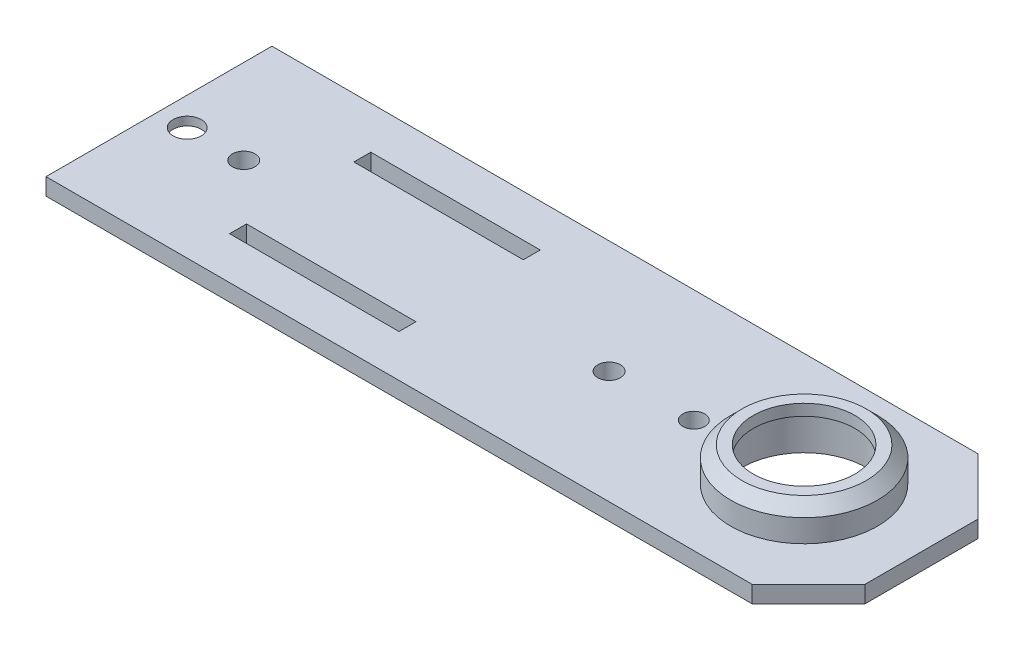
from build123d import *

# Parameters (mm, degrees)
CROQUIS1_R              = 11
CROQUIS1_R_2            = 2
CROQUIS1_R_3            = 1.937672591
CROQUIS1_W              = 30
CROQUIS1_H              = 3
SALIENTE_EXTRUIR1_DEPTH = 3
CROQUIS2_R              = 13
CROQUIS2_R_2            = 11
SALIENTE_EXTRUIR2_DEPTH = 4
CROQUIS3_R              = 13
CROQUIS3_R_2            = 9
SALIENTE_EXTRUIR3_DEPTH = 2
CHAFL_N1_SIZE           = 2
CHAFL_N2_SIZE           = 10
CROQUIS4_W              = 10
CROQUIS4_H              = 20
CROQUIS4_R              = 2.5
SALIENTE_EXTRUIR4_DEPTH = 1.5


with BuildPart() as part:
    # Croquis1 → Saliente-Extruir1 (new body)
    with BuildSketch(Plane(origin=(0, 0, 0), x_dir=(1, 0, 0), z_dir=(0, 1, 0))):
        Polygon((-67.5, -20), (67.5, -20), (67.5, 20), (-67.5, 20), (-67.5, 10), (-57.5, 10), (-57.5, -10), (-67.5, -10), align=None)
        with Locations(Location((46.713951104, 0, 0), (0, 0, 270))):
            Circle(CROQUIS1_R, mode=Mode.SUBTRACT)
        with Locations(Location((-52.5, 0, 0), (0, 0, 270))):
            Circle(CROQUIS1_R_2, mode=Mode.SUBTRACT)
        with Locations(Location((27.185770037, 0, 0), (0, 0, 270))):
            Circle(CROQUIS1_R_3, mode=Mode.SUBTRACT)
        with Locations(Location((12.185770037, 0, 0), (0, 0, 270))):
            Circle(CROQUIS1_R_2, mode=Mode.SUBTRACT)
        with Locations((-27.5, 11)):
            Rectangle(CROQUIS1_W, CROQUIS1_H, mode=Mode.SUBTRACT)
        with Locations((-27.5, -11)):
            Rectangle(CROQUIS1_W, CROQUIS1_H, mode=Mode.SUBTRACT)
    extrude(amount=SALIENTE_EXTRUIR1_DEPTH)

    # Croquis2 → Saliente-Extruir2 (add)
    with BuildSketch(Plane(origin=(0, 3, 0), x_dir=(1, 0, 0), z_dir=(0, 1, 0))):
        with Locations(Location((46.713951104, 0, 0), (0, 0, 90))):
            Circle(CROQUIS2_R)
        with Locations(Location((46.713951104, 0, 0), (0, 0, 270))):
            Circle(CROQUIS2_R_2, mode=Mode.SUBTRACT)
    extrude(amount=SALIENTE_EXTRUIR2_DEPTH)

    # Croquis3 → Saliente-Extruir3 (add)
    with BuildSketch(Plane(origin=(0, 7, 0), x_dir=(1, 0, 0), z_dir=(0, 1, 0))):
        with Locations(Location((46.713951104, 0, 0), (0, 0, 90))):
            Circle(CROQUIS3_R)
        with Locations(Location((46.713951104, 0, 0), (0, 0, 270))):
            Circle(CROQUIS3_R_2, mode=Mode.SUBTRACT)
    extrude(amount=SALIENTE_EXTRUIR3_DEPTH)

    # Chaflán1
    chafl_n1_edges = [part.edges().sort_by_distance(p)[0] for p in [
        (46.713951104, 9, 13),
    ]]
    chamfer(chafl_n1_edges, length=CHAFL_N1_SIZE)

    # Chaflán2
    chafl_n2_edges = [part.edges().sort_by_distance(p)[0] for p in [
        (67.5, 1.5, 20),
        (67.5, 1.5, -20),
    ]]
    chamfer(chafl_n2_edges, length=CHAFL_N2_SIZE)

    # Croquis4 → Saliente-Extruir4 (add)
    with BuildSketch(Plane(origin=(0, 3, 0), x_dir=(1, 0, 0), z_dir=(0, 1, 0))):
        with Locations((-62.5, 0)):
            Rectangle(CROQUIS4_W, CROQUIS4_H)
        with Locations(Location((-62.5, 0, 0), (0, 0, 270))):
            Circle(CROQUIS4_R, mode=Mode.SUBTRACT)
    extrude(amount=-SALIENTE_EXTRUIR4_DEPTH)


solid = part.part
